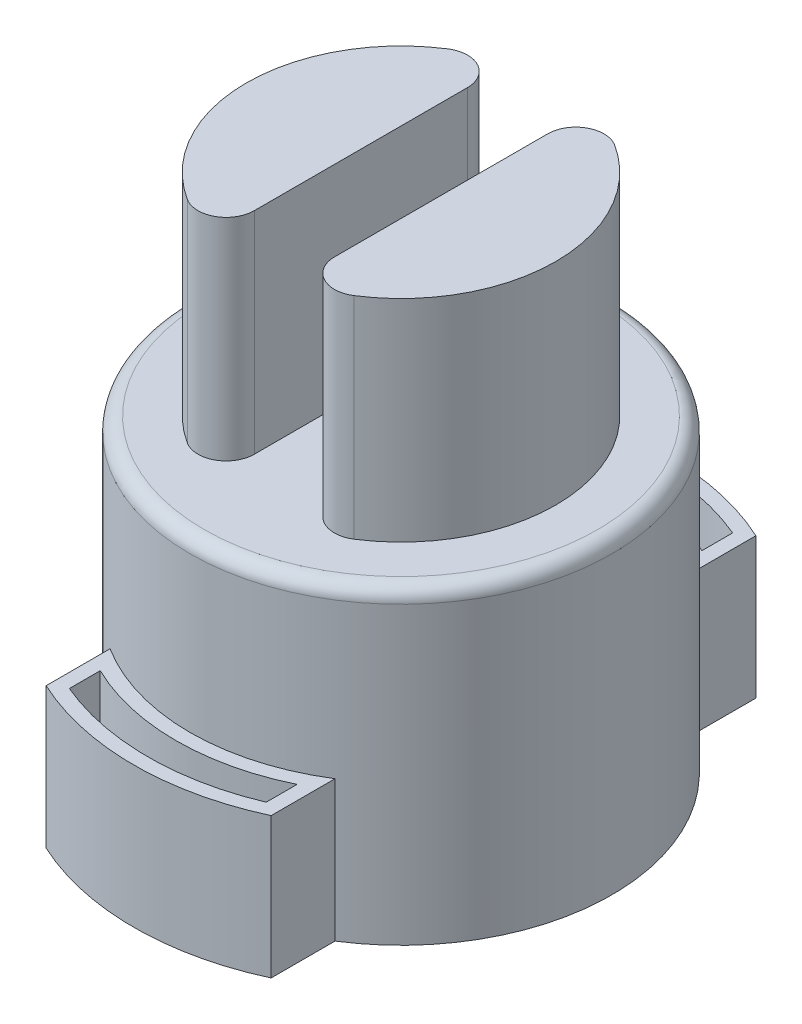
from build123d import *

# Parameters (mm, degrees)
SKETCH1_R           = 15
BOSS_EXTRUDE1_DEPTH = 20
SKETCH2_R           = 11
BOSS_EXTRUDE2_DEPTH = 15
SKETCH3_W           = 5.7
SKETCH3_H           = 24
CUT_EXTRUDE1_DEPTH  = 15
FILLET3_R           = 1
FILLET4_R           = 2
BOSS_EXTRUDE3_DEPTH = 2
BOSS_EXTRUDE4_START = -10
BOSS_EXTRUDE4_DEPTH = 10
CUT_EXTRUDE2_DEPTH  = 11
CUT_EXTRUDE3_DEPTH  = 11


with BuildPart() as part:
    # Sketch1 → Boss-Extrude1 (new body)
    with BuildSketch(Plane(origin=(0, 0, 0), x_dir=(1, 0, 0), z_dir=(0, 1, 0))):
        with Locations(Location((0, 0, 0), (0, 0, 270))):
            Circle(SKETCH1_R)
    extrude(amount=-BOSS_EXTRUDE1_DEPTH)

    # Sketch2 → Boss-Extrude2 (add)
    with BuildSketch(Plane(origin=(0, 0, 0), x_dir=(1, 0, 0), z_dir=(0, 1, 0))):
        with Locations(Location((0, 0, 0), (0, 0, 270))):
            Circle(SKETCH2_R)
    extrude(amount=BOSS_EXTRUDE2_DEPTH)

    # Sketch3 → Cut-Extrude1 (cut)
    with BuildSketch(Plane(origin=(0, 15, 0), x_dir=(1, 0, 0), z_dir=(0, 1, 0))):
        Rectangle(SKETCH3_W, SKETCH3_H)
    extrude(amount=-CUT_EXTRUDE1_DEPTH, mode=Mode.SUBTRACT)

    # Fillet3
    fillet3_edges = [part.edges().sort_by_distance(p)[0] for p in [
        (0, 0, -15),
    ]]
    fillet(fillet3_edges, radius=FILLET3_R)

    # Fillet4
    fillet4_edges = [part.edges().sort_by_distance(p)[0] for p in [
        (-2.85, 7.5, -10.624382335),
        (-2.85, 7.5, 10.624382335),
        (2.85, 7.5, 10.624382335),
        (2.85, 7.5, -10.624382335),
    ]]
    fillet(fillet4_edges, radius=FILLET4_R)

    # Sketch4 → Boss-Extrude3 (add)
    with BuildSketch(Plane.XZ.offset(20)):
        with BuildLine():
            ThreePointArc((8, 12.68857754), (0, 15), (-8, 12.68857754))
            Line((-8, 12.68857754), (-8, -12.68857754))
            ThreePointArc((-8, -12.68857754), (0, -15), (8, -12.68857754))
            Line((8, -12.68857754), (8, 12.68857754))
        make_face()
        with BuildLine():
            ThreePointArc((8, 17.23368794), (0, 19), (-8, 17.23368794))
            Line((-8, 17.23368794), (-8, 12.68857754))
            ThreePointArc((-8, 12.68857754), (0, 15), (8, 12.68857754))
            Line((8, 12.68857754), (8, 17.23368794))
        make_face()
        with BuildLine():
            Line((-8, -12.68857754), (-8, -17.23368794))
            ThreePointArc((-8, -17.23368794), (0, -19), (8, -17.23368794))
            Line((8, -17.23368794), (8, -12.68857754))
            ThreePointArc((8, -12.68857754), (0, -15), (-8, -12.68857754))
        make_face()
        with BuildLine():
            Line((-8, -12.68857754), (-8, 12.68857754))
            ThreePointArc((-8, 12.68857754), (-15, 0), (-8, -12.68857754))
        make_face()
        with BuildLine():
            ThreePointArc((15, 0), (13.133925537, 7.245688373), (8, 12.68857754))
            Line((8, 12.68857754), (8, -12.68857754))
            ThreePointArc((8, -12.68857754), (13.133925537, -7.245688373), (15, 0))
        make_face()
    extrude(amount=BOSS_EXTRUDE3_DEPTH)

    # Sketch7 → Boss-Extrude4 (add)
    with BuildSketch(Plane.XZ.offset(22).offset(BOSS_EXTRUDE4_START)):
        with BuildLine():
            Line((-8, -12.68857754), (-8, -17.23368794))
            ThreePointArc((-8, -17.23368794), (0, -19), (8, -17.23368794))
            Line((8, -17.23368794), (8, -12.68857754))
            ThreePointArc((8, -12.68857754), (0, -15), (-8, -12.68857754))
        make_face()
        with BuildLine():
            ThreePointArc((8, 17.23368794), (0, 19), (-8, 17.23368794))
            Line((-8, 17.23368794), (-8, 12.68857754))
            ThreePointArc((-8, 12.68857754), (0, 15), (8, 12.68857754))
            Line((8, 12.68857754), (8, 17.23368794))
        make_face()
    extrude(amount=BOSS_EXTRUDE4_DEPTH)

    # Sketch8 → Cut-Extrude2 (cut)
    with BuildSketch(Plane(origin=(0, -12, 0), x_dir=(1, 0, 0), z_dir=(0, 1, 0))):
        with BuildLine():
            Line((7, 14.38749457), (7, 16.583123952))
            ThreePointArc((7, 16.583123952), (0, 18), (-7, 16.583123952))
            Line((-7, 16.583123952), (-7, 14.38749457))
            ThreePointArc((-7, 14.38749457), (0, 16), (7, 14.38749457))
        make_face()
    extrude(amount=-CUT_EXTRUDE2_DEPTH, mode=Mode.SUBTRACT)

    # Sketch9 → Cut-Extrude3 (cut)
    with BuildSketch(Plane(origin=(0, -12, 0), x_dir=(1, 0, 0), z_dir=(0, 1, 0))):
        with BuildLine():
            Line((-7, -14.38749457), (-7, -16.583123952))
            ThreePointArc((-7, -16.583123952), (0, -18), (7, -16.583123952))
            Line((7, -16.583123952), (7, -14.38749457))
            ThreePointArc((7, -14.38749457), (0, -16), (-7, -14.38749457))
        make_face()
    extrude(amount=-CUT_EXTRUDE3_DEPTH, mode=Mode.SUBTRACT)


solid = part.part
